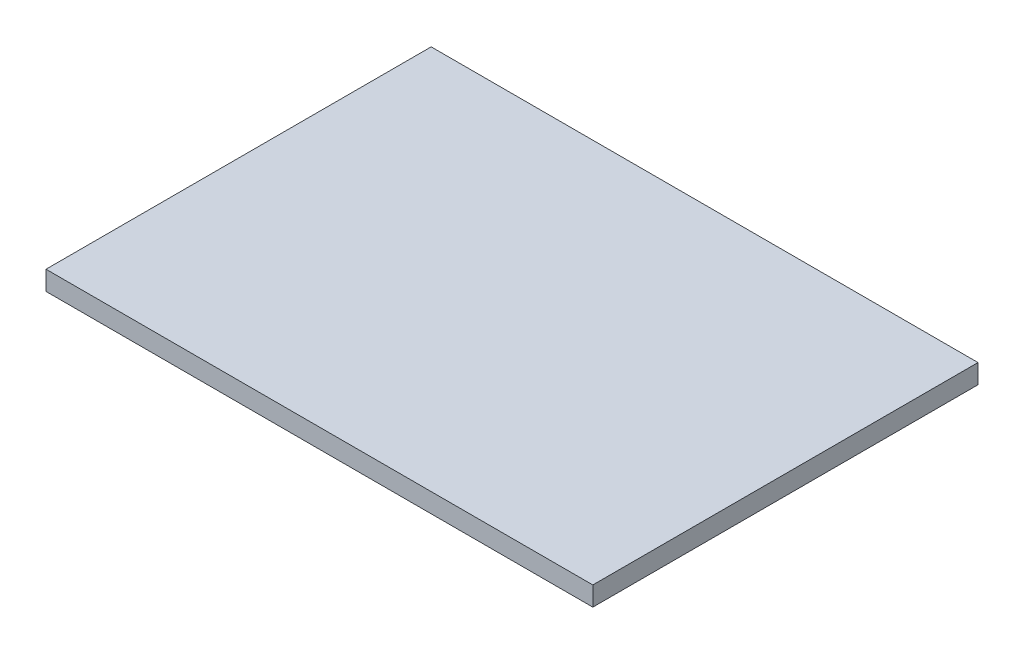
from build123d import *

# Parameters (mm, degrees)
SKETCH1_W           = 180.3
SKETCH1_H           = 127
BOSS_EXTRUDE1_DEPTH = 6.35


with BuildPart() as part:
    # Sketch1 → Boss-Extrude1 (new body)
    with BuildSketch(Plane(origin=(0, 0, 0), x_dir=(1, 0, 0), z_dir=(0, 1, 0))):
        with Locations((90.15, -63.5)):
            Rectangle(SKETCH1_W, SKETCH1_H)
    extrude(amount=BOSS_EXTRUDE1_DEPTH)


solid = part.part
